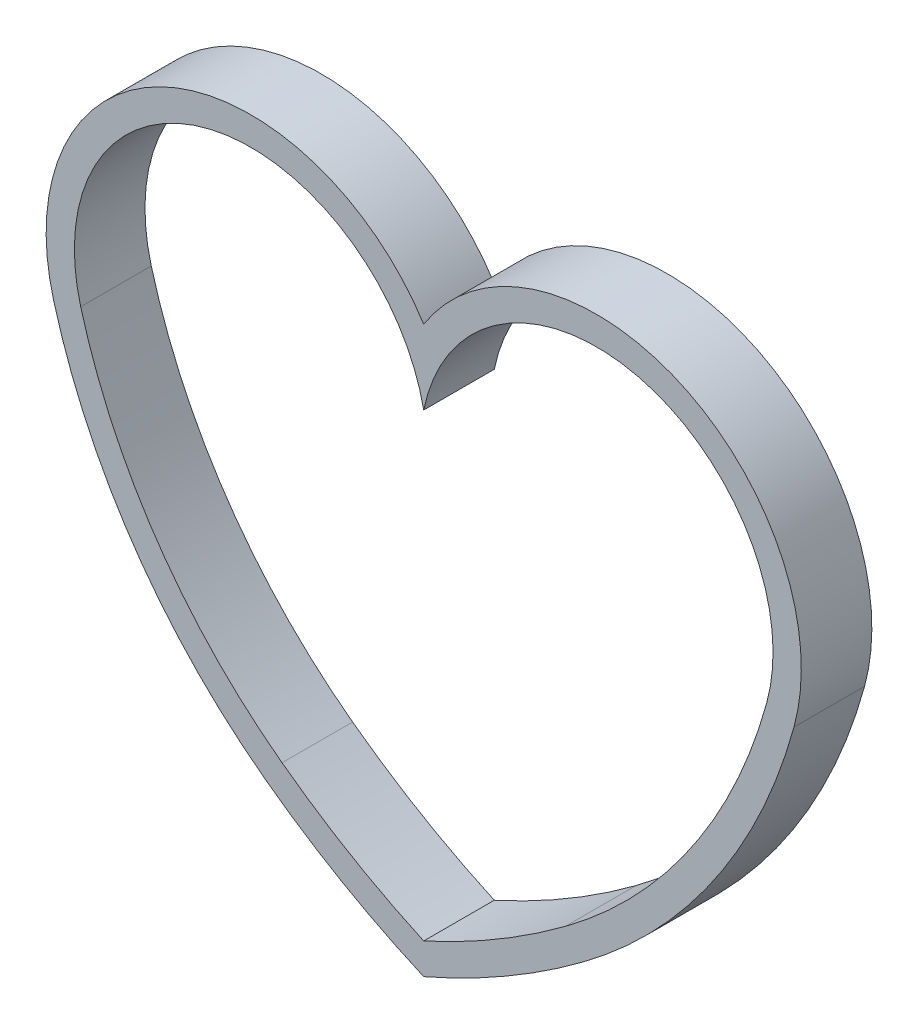
from build123d import *

# Parameters (mm, degrees)
BOSS_EXTRUDE1_DEPTH = 2.54


with BuildPart() as part:
    # Sketch1 → Boss-Extrude1 (new body)
    with BuildSketch(Plane.XY):
        with BuildLine():
            ThreePointArc((-13.324567367, -3.22122711), (-9.201637253, 5.466316018), (0, 2.673140373))
            ThreePointArc((0, 2.673140373), (9.201637253, 5.466316018), (13.324567367, -3.22122711))
            ThreePointArc((13.324567367, -3.22122711), (10.447333261, -9.42774786), (5.704348435, -14.357602914))
            ThreePointArc((5.704348435, -14.357602914), (2.946415451, -16.171190718), (0, -17.659119163))
            ThreePointArc((0, -17.659119163), (-2.946415451, -16.171190718), (-5.704348435, -14.357602914))
            ThreePointArc((-5.704348435, -14.357602914), (-10.447333261, -9.42774786), (-13.324567367, -3.22122711))
        make_face()
        with BuildLine():
            ThreePointArc((12.344862067, -2.952092336), (7.698572292, 4.905869161), (0, 0))
            ThreePointArc((0, 0), (-7.698572292, 4.905869161), (-12.344862067, -2.952092336))
            ThreePointArc((-12.344862067, -2.952092336), (-9.608841906, -8.853998571), (-5.098641611, -13.541897549))
            ThreePointArc((-5.098641611, -13.541897549), (-2.629119582, -15.179915612), (0, -16.547165572))
            ThreePointArc((0, -16.547165572), (2.629119582, -15.179915612), (5.098641611, -13.541897549))
            ThreePointArc((5.098641611, -13.541897549), (9.608841906, -8.853998571), (12.344862067, -2.952092336))
        make_face(mode=Mode.SUBTRACT)
    extrude(amount=BOSS_EXTRUDE1_DEPTH)


solid = part.part
